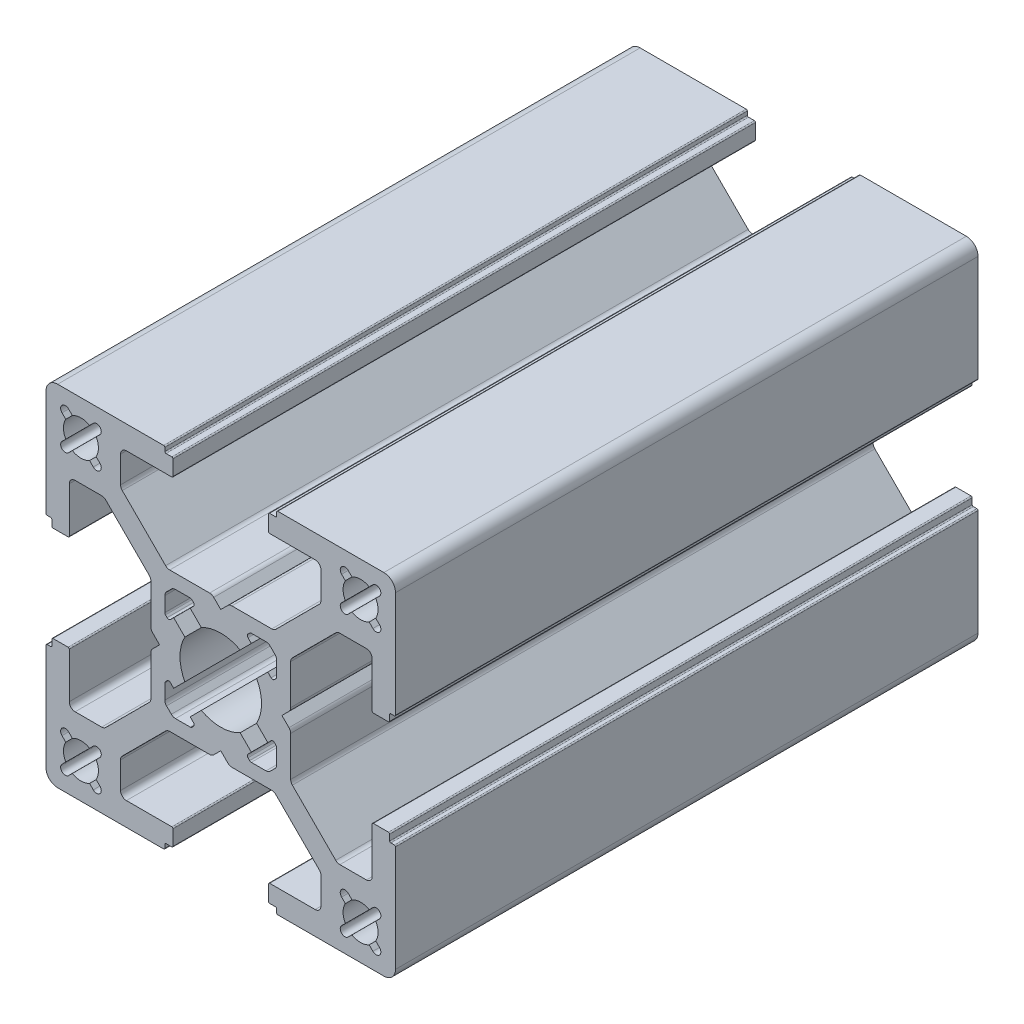
from build123d import *

# Parameters (mm, degrees)
Y_KSEKLIK_EKSTR_ZYON1_DEPTH = 50


with BuildPart() as part:
    # Çizim1 → Yükseklik-Ekstrüzyon1 (new body)
    with BuildSketch(Plane.XY):
        with BuildLine():
            Line((-4.8, 14.6), (-4.8, 14.9))
            ThreePointArc((-4.8, 14.9), (-4.829289322, 14.970710678), (-4.9, 15))
            Line((-4.9, 15), (-14, 15))
            ThreePointArc((-14, 15), (-14.707106781, 14.707106781), (-15, 14))
            Line((-15, 14), (-15, 4.9))
            ThreePointArc((-15, 4.9), (-14.970710678, 4.829289322), (-14.9, 4.8))
            Line((-14.9, 4.8), (-14.6, 4.8))
            ThreePointArc((-14.6, 4.8), (-14.529289322, 4.770710678), (-14.5, 4.7))
            Line((-14.5, 4.7), (-14.5, 4.2))
            ThreePointArc((-14.5, 4.2), (-14.470710678, 4.129289322), (-14.4, 4.1))
            Line((-14.4, 4.1), (-13.1, 4.1))
            ThreePointArc((-13.1, 4.1), (-13.029289322, 4.129289322), (-13, 4.2))
            Line((-13, 4.2), (-13, 8.1))
            ThreePointArc((-13, 8.1), (-12.853553391, 8.453553391), (-12.5, 8.6))
            Line((-12.5, 8.6), (-10.221320344, 8.6))
            ThreePointArc((-10.221320344, 8.6), (-10.029978627, 8.561939766), (-9.867766953, 8.453553391))
            Line((-9.867766953, 8.453553391), (-6.146446609, 4.732233047))
            ThreePointArc((-6.146446609, 4.732233047), (-6.038060234, 4.570021373), (-6, 4.378679656))
            Line((-6, 4.378679656), (-6, 0.957106781))
            ThreePointArc((-6, 0.957106781), (-5.961939766, 0.765765065), (-5.853553391, 0.603553391))
            Line((-5.853553391, 0.603553391), (-5.25, 0))
            Line((-5.25, 0), (-5.853553391, -0.603553391))
            ThreePointArc((-5.853553391, -0.603553391), (-5.961939766, -0.765765065), (-6, -0.957106781))
            Line((-6, -0.957106781), (-6, -4.378679656))
            ThreePointArc((-6, -4.378679656), (-6.038060234, -4.570021373), (-6.146446609, -4.732233047))
            Line((-6.146446609, -4.732233047), (-9.867766953, -8.453553391))
            ThreePointArc((-9.867766953, -8.453553391), (-10.029978627, -8.561939766), (-10.221320344, -8.6))
            Line((-10.221320344, -8.6), (-12.5, -8.6))
            ThreePointArc((-12.5, -8.6), (-12.853553391, -8.453553391), (-13, -8.1))
            Line((-13, -8.1), (-13, -4.2))
            ThreePointArc((-13, -4.2), (-13.029289322, -4.129289322), (-13.1, -4.1))
            Line((-13.1, -4.1), (-14.4, -4.1))
            ThreePointArc((-14.4, -4.1), (-14.470710678, -4.129289322), (-14.5, -4.2))
            Line((-14.5, -4.2), (-14.5, -4.7))
            ThreePointArc((-14.5, -4.7), (-14.529289322, -4.770710678), (-14.6, -4.8))
            Line((-14.6, -4.8), (-14.9, -4.8))
            ThreePointArc((-14.9, -4.8), (-14.970710678, -4.829289322), (-15, -4.9))
            Line((-15, -4.9), (-15, -14))
            ThreePointArc((-15, -14), (-14.707106781, -14.707106781), (-14, -15))
            Line((-14, -15), (-4.9, -15))
            ThreePointArc((-4.9, -15), (-4.829289322, -14.970710678), (-4.8, -14.9))
            Line((-4.8, -14.9), (-4.8, -14.6))
            ThreePointArc((-4.8, -14.6), (-4.770710678, -14.529289322), (-4.7, -14.5))
            Line((-4.7, -14.5), (-4.2, -14.5))
            ThreePointArc((-4.2, -14.5), (-4.129289322, -14.470710678), (-4.1, -14.4))
            Line((-4.1, -14.4), (-4.1, -13.1))
            ThreePointArc((-4.1, -13.1), (-4.129289322, -13.029289322), (-4.2, -13))
            Line((-4.2, -13), (-8.1, -13))
            ThreePointArc((-8.1, -13), (-8.453553391, -12.853553391), (-8.6, -12.5))
            Line((-8.6, -12.5), (-8.6, -10.221320344))
            ThreePointArc((-8.6, -10.221320344), (-8.561939766, -10.029978627), (-8.453553391, -9.867766953))
            Line((-8.453553391, -9.867766953), (-4.732233047, -6.146446609))
            ThreePointArc((-4.732233047, -6.146446609), (-4.570021373, -6.038060234), (-4.378679656, -6))
            Line((-4.378679656, -6), (-0.957106781, -6))
            ThreePointArc((-0.957106781, -6), (-0.765765065, -5.961939766), (-0.603553391, -5.853553391))
            Line((-0.603553391, -5.853553391), (0, -5.25))
            Line((0, -5.25), (0.603553391, -5.853553391))
            ThreePointArc((0.603553391, -5.853553391), (0.765765065, -5.961939766), (0.957106781, -6))
            Line((0.957106781, -6), (4.378679656, -6))
            ThreePointArc((4.378679656, -6), (4.570021373, -6.038060234), (4.732233047, -6.146446609))
            Line((4.732233047, -6.146446609), (8.453553391, -9.867766953))
            ThreePointArc((8.453553391, -9.867766953), (8.561939766, -10.029978627), (8.6, -10.221320344))
            Line((8.6, -10.221320344), (8.6, -12.5))
            ThreePointArc((8.6, -12.5), (8.453553391, -12.853553391), (8.1, -13))
            Line((8.1, -13), (4.2, -13))
            ThreePointArc((4.2, -13), (4.129289322, -13.029289322), (4.1, -13.1))
            Line((4.1, -13.1), (4.1, -14.4))
            ThreePointArc((4.1, -14.4), (4.129289322, -14.470710678), (4.2, -14.5))
            Line((4.2, -14.5), (4.7, -14.5))
            ThreePointArc((4.7, -14.5), (4.770710678, -14.529289322), (4.8, -14.6))
            Line((4.8, -14.6), (4.8, -14.9))
            ThreePointArc((4.8, -14.9), (4.829289322, -14.970710678), (4.9, -15))
            Line((4.9, -15), (14, -15))
            ThreePointArc((14, -15), (14.707106781, -14.707106781), (15, -14))
            Line((15, -14), (15, -4.9))
            ThreePointArc((15, -4.9), (14.970710678, -4.829289322), (14.9, -4.8))
            Line((14.9, -4.8), (14.6, -4.8))
            ThreePointArc((14.6, -4.8), (14.529289322, -4.770710678), (14.5, -4.7))
            Line((14.5, -4.7), (14.5, -4.2))
            ThreePointArc((14.5, -4.2), (14.470710678, -4.129289322), (14.4, -4.1))
            Line((14.4, -4.1), (13.1, -4.1))
            ThreePointArc((13.1, -4.1), (13.029289322, -4.129289322), (13, -4.2))
            Line((13, -4.2), (13, -8.1))
            ThreePointArc((13, -8.1), (12.853553391, -8.453553391), (12.5, -8.6))
            Line((12.5, -8.6), (10.221320344, -8.6))
            ThreePointArc((10.221320344, -8.6), (10.029978627, -8.561939766), (9.867766953, -8.453553391))
            Line((9.867766953, -8.453553391), (6.146446609, -4.732233047))
            ThreePointArc((6.146446609, -4.732233047), (6.038060234, -4.570021373), (6, -4.378679656))
            Line((6, -4.378679656), (6, -0.957106781))
            ThreePointArc((6, -0.957106781), (5.961939766, -0.765765065), (5.853553391, -0.603553391))
            Line((5.853553391, -0.603553391), (5.25, 0))
            Line((5.25, 0), (5.853553391, 0.603553391))
            ThreePointArc((5.853553391, 0.603553391), (5.961939766, 0.765765065), (6, 0.957106781))
            Line((6, 0.957106781), (6, 4.378679656))
            ThreePointArc((6, 4.378679656), (6.038060234, 4.570021373), (6.146446609, 4.732233047))
            Line((6.146446609, 4.732233047), (9.867766953, 8.453553391))
            ThreePointArc((9.867766953, 8.453553391), (10.029978627, 8.561939766), (10.221320344, 8.6))
            Line((10.221320344, 8.6), (12.5, 8.6))
            ThreePointArc((12.5, 8.6), (12.853553391, 8.453553391), (13, 8.1))
            Line((13, 8.1), (13, 4.2))
            ThreePointArc((13, 4.2), (13.029289322, 4.129289322), (13.1, 4.1))
            Line((13.1, 4.1), (14.4, 4.1))
            ThreePointArc((14.4, 4.1), (14.470710678, 4.129289322), (14.5, 4.2))
            Line((14.5, 4.2), (14.5, 4.7))
            ThreePointArc((14.5, 4.7), (14.529289322, 4.770710678), (14.6, 4.8))
            Line((14.6, 4.8), (14.9, 4.8))
            ThreePointArc((14.9, 4.8), (14.970710678, 4.829289322), (15, 4.9))
            Line((15, 4.9), (15, 14))
            ThreePointArc((15, 14), (14.707106781, 14.707106781), (14, 15))
            Line((14, 15), (4.9, 15))
            ThreePointArc((4.9, 15), (4.829289322, 14.970710678), (4.8, 14.9))
            Line((4.8, 14.9), (4.8, 14.6))
            ThreePointArc((4.8, 14.6), (4.770710678, 14.529289322), (4.7, 14.5))
            Line((4.7, 14.5), (4.2, 14.5))
            ThreePointArc((4.2, 14.5), (4.129289322, 14.470710678), (4.1, 14.4))
            Line((4.1, 14.4), (4.1, 13.1))
            ThreePointArc((4.1, 13.1), (4.129289322, 13.029289322), (4.2, 13))
            Line((4.2, 13), (8.1, 13))
            ThreePointArc((8.1, 13), (8.453553391, 12.853553391), (8.6, 12.5))
            Line((8.6, 12.5), (8.6, 10.221320344))
            ThreePointArc((8.6, 10.221320344), (8.561939766, 10.029978627), (8.453553391, 9.867766953))
            Line((8.453553391, 9.867766953), (4.732233047, 6.146446609))
            ThreePointArc((4.732233047, 6.146446609), (4.570021373, 6.038060234), (4.378679656, 6))
            Line((4.378679656, 6), (0.957106781, 6))
            ThreePointArc((0.957106781, 6), (0.765765065, 5.961939766), (0.603553391, 5.853553391))
            Line((0.603553391, 5.853553391), (0, 5.25))
            Line((0, 5.25), (-0.603553391, 5.853553391))
            ThreePointArc((-0.603553391, 5.853553391), (-0.765765065, 5.961939766), (-0.957106781, 6))
            Line((-0.957106781, 6), (-4.378679656, 6))
            ThreePointArc((-4.378679656, 6), (-4.570021373, 6.038060234), (-4.732233047, 6.146446609))
            Line((-4.732233047, 6.146446609), (-8.453553391, 9.867766953))
            ThreePointArc((-8.453553391, 9.867766953), (-8.561939766, 10.029978627), (-8.6, 10.221320344))
            Line((-8.6, 10.221320344), (-8.6, 12.5))
            ThreePointArc((-8.6, 12.5), (-8.453553391, 12.853553391), (-8.1, 13))
            Line((-8.1, 13), (-4.2, 13))
            ThreePointArc((-4.2, 13), (-4.129289322, 13.029289322), (-4.1, 13.1))
            Line((-4.1, 13.1), (-4.1, 14.4))
            ThreePointArc((-4.1, 14.4), (-4.129289322, 14.470710678), (-4.2, 14.5))
            Line((-4.2, 14.5), (-4.7, 14.5))
            ThreePointArc((-4.7, 14.5), (-4.770710678, 14.529289322), (-4.8, 14.6))
        make_face()
        with BuildLine():
            Line((-1.664601464, -3.078815026), (-2.624264069, -4.038477631))
            Line((-2.624264069, -4.038477631), (-2.341421356, -4.321320344))
            ThreePointArc((-2.341421356, -4.321320344), (-2.282842712, -4.4627417), (-2.341421356, -4.604163056))
            Line((-2.341421356, -4.604163056), (-2.478679656, -4.741421356))
            ThreePointArc((-2.478679656, -4.741421356), (-2.543564326, -4.784775907), (-2.620101013, -4.8))
            Line((-2.620101013, -4.8), (-3.885786438, -4.8))
            ThreePointArc((-3.885786438, -4.8), (-4.077128154, -4.761939766), (-4.239339828, -4.653553391))
            Line((-4.239339828, -4.653553391), (-4.653553391, -4.239339828))
            ThreePointArc((-4.653553391, -4.239339828), (-4.761939766, -4.077128154), (-4.8, -3.885786438))
            Line((-4.8, -3.885786438), (-4.8, -2.620101013))
            ThreePointArc((-4.8, -2.620101013), (-4.784775907, -2.543564326), (-4.741421356, -2.478679656))
            Line((-4.741421356, -2.478679656), (-4.604163056, -2.341421356))
            ThreePointArc((-4.604163056, -2.341421356), (-4.4627417, -2.282842712), (-4.321320344, -2.341421356))
            Line((-4.321320344, -2.341421356), (-4.038477631, -2.624264069))
            Line((-4.038477631, -2.624264069), (-3.078815026, -1.664601464))
            ThreePointArc((-3.078815026, -1.664601464), (-3.5, 0), (-3.078815026, 1.664601464))
            Line((-3.078815026, 1.664601464), (-4.038477631, 2.624264069))
            Line((-4.038477631, 2.624264069), (-4.321320344, 2.341421356))
            ThreePointArc((-4.321320344, 2.341421356), (-4.4627417, 2.282842712), (-4.604163056, 2.341421356))
            Line((-4.604163056, 2.341421356), (-4.741421356, 2.478679656))
            ThreePointArc((-4.741421356, 2.478679656), (-4.784775907, 2.543564326), (-4.8, 2.620101013))
            Line((-4.8, 2.620101013), (-4.8, 3.885786438))
            ThreePointArc((-4.8, 3.885786438), (-4.761939766, 4.077128154), (-4.653553391, 4.239339828))
            Line((-4.653553391, 4.239339828), (-4.239339828, 4.653553391))
            ThreePointArc((-4.239339828, 4.653553391), (-4.077128154, 4.761939766), (-3.885786438, 4.8))
            Line((-3.885786438, 4.8), (-2.620101013, 4.8))
            ThreePointArc((-2.620101013, 4.8), (-2.543564326, 4.784775907), (-2.478679656, 4.741421356))
            Line((-2.478679656, 4.741421356), (-2.341421356, 4.604163056))
            ThreePointArc((-2.341421356, 4.604163056), (-2.282842712, 4.4627417), (-2.341421356, 4.321320344))
            Line((-2.341421356, 4.321320344), (-2.624264069, 4.038477631))
            Line((-2.624264069, 4.038477631), (-1.664601464, 3.078815026))
            ThreePointArc((-1.664601464, 3.078815026), (0, 3.5), (1.664601464, 3.078815026))
            Line((1.664601464, 3.078815026), (2.624264069, 4.038477631))
            Line((2.624264069, 4.038477631), (2.341421356, 4.321320344))
            ThreePointArc((2.341421356, 4.321320344), (2.282842712, 4.4627417), (2.341421356, 4.604163056))
            Line((2.341421356, 4.604163056), (2.478679656, 4.741421356))
            ThreePointArc((2.478679656, 4.741421356), (2.543564326, 4.784775907), (2.620101013, 4.8))
            Line((2.620101013, 4.8), (3.885786438, 4.8))
            ThreePointArc((3.885786438, 4.8), (4.077128154, 4.761939766), (4.239339828, 4.653553391))
            Line((4.239339828, 4.653553391), (4.653553391, 4.239339828))
            ThreePointArc((4.653553391, 4.239339828), (4.761939766, 4.077128154), (4.8, 3.885786438))
            Line((4.8, 3.885786438), (4.8, 2.620101013))
            ThreePointArc((4.8, 2.620101013), (4.784775907, 2.543564326), (4.741421356, 2.478679656))
            Line((4.741421356, 2.478679656), (4.604163056, 2.341421356))
            ThreePointArc((4.604163056, 2.341421356), (4.4627417, 2.282842712), (4.321320344, 2.341421356))
            Line((4.321320344, 2.341421356), (4.038477631, 2.624264069))
            Line((4.038477631, 2.624264069), (3.078815026, 1.664601464))
            ThreePointArc((3.078815026, 1.664601464), (3.5, 0), (3.078815026, -1.664601464))
            Line((3.078815026, -1.664601464), (4.038477631, -2.624264069))
            Line((4.038477631, -2.624264069), (4.321320344, -2.341421356))
            ThreePointArc((4.321320344, -2.341421356), (4.4627417, -2.282842712), (4.604163056, -2.341421356))
            Line((4.604163056, -2.341421356), (4.741421356, -2.478679656))
            ThreePointArc((4.741421356, -2.478679656), (4.784775907, -2.543564326), (4.8, -2.620101013))
            Line((4.8, -2.620101013), (4.8, -3.885786438))
            ThreePointArc((4.8, -3.885786438), (4.761939766, -4.077128154), (4.653553391, -4.239339828))
            Line((4.653553391, -4.239339828), (4.239339828, -4.653553391))
            ThreePointArc((4.239339828, -4.653553391), (4.077128154, -4.761939766), (3.885786438, -4.8))
            Line((3.885786438, -4.8), (2.620101013, -4.8))
            ThreePointArc((2.620101013, -4.8), (2.543564326, -4.784775907), (2.478679656, -4.741421356))
            Line((2.478679656, -4.741421356), (2.341421356, -4.604163056))
            ThreePointArc((2.341421356, -4.604163056), (2.282842712, -4.4627417), (2.341421356, -4.321320344))
            Line((2.341421356, -4.321320344), (2.624264069, -4.038477631))
            Line((2.624264069, -4.038477631), (1.664601464, -3.078815026))
            ThreePointArc((1.664601464, -3.078815026), (0, -3.5), (-1.664601464, -3.078815026))
        make_face(mode=Mode.SUBTRACT)
        with BuildLine():
            ThreePointArc((-12.739409703, 13.305095127), (-12, 13.5), (-11.260590297, 13.305095127))
            Line((-11.260590297, 13.305095127), (-10.939339828, 13.626345597))
            ThreePointArc((-10.939339828, 13.626345597), (-10.373654403, 13.626345597), (-10.373654403, 13.060660172))
            Line((-10.373654403, 13.060660172), (-10.694904873, 12.739409703))
            ThreePointArc((-10.694904873, 12.739409703), (-10.5, 12), (-10.694904873, 11.260590297))
            Line((-10.694904873, 11.260590297), (-10.373654403, 10.939339828))
            ThreePointArc((-10.373654403, 10.939339828), (-10.373654403, 10.373654403), (-10.939339828, 10.373654403))
            Line((-10.939339828, 10.373654403), (-11.260590297, 10.694904873))
            ThreePointArc((-11.260590297, 10.694904873), (-12, 10.5), (-12.739409703, 10.694904873))
            Line((-12.739409703, 10.694904873), (-13.060660172, 10.373654403))
            ThreePointArc((-13.060660172, 10.373654403), (-13.626345597, 10.373654403), (-13.626345597, 10.939339828))
            Line((-13.626345597, 10.939339828), (-13.305095127, 11.260590297))
            ThreePointArc((-13.305095127, 11.260590297), (-13.5, 12), (-13.305095127, 12.739409703))
            Line((-13.305095127, 12.739409703), (-13.626345597, 13.060660172))
            ThreePointArc((-13.626345597, 13.060660172), (-13.626345597, 13.626345597), (-13.060660172, 13.626345597))
            Line((-13.060660172, 13.626345597), (-12.739409703, 13.305095127))
        make_face(mode=Mode.SUBTRACT)
        with BuildLine():
            Line((13.305095127, 11.260590297), (13.626345597, 10.939339828))
            ThreePointArc((13.626345597, 10.939339828), (13.626345597, 10.373654403), (13.060660172, 10.373654403))
            Line((13.060660172, 10.373654403), (12.739409703, 10.694904873))
            ThreePointArc((12.739409703, 10.694904873), (12, 10.5), (11.260590297, 10.694904873))
            Line((11.260590297, 10.694904873), (10.939339828, 10.373654403))
            ThreePointArc((10.939339828, 10.373654403), (10.373654403, 10.373654403), (10.373654403, 10.939339828))
            Line((10.373654403, 10.939339828), (10.694904873, 11.260590297))
            ThreePointArc((10.694904873, 11.260590297), (10.5, 12), (10.694904873, 12.739409703))
            Line((10.694904873, 12.739409703), (10.373654403, 13.060660172))
            ThreePointArc((10.373654403, 13.060660172), (10.373654403, 13.626345597), (10.939339828, 13.626345597))
            Line((10.939339828, 13.626345597), (11.260590297, 13.305095127))
            ThreePointArc((11.260590297, 13.305095127), (12, 13.5), (12.739409703, 13.305095127))
            Line((12.739409703, 13.305095127), (13.060660172, 13.626345597))
            ThreePointArc((13.060660172, 13.626345597), (13.626345597, 13.626345597), (13.626345597, 13.060660172))
            Line((13.626345597, 13.060660172), (13.305095127, 12.739409703))
            ThreePointArc((13.305095127, 12.739409703), (13.5, 12), (13.305095127, 11.260590297))
        make_face(mode=Mode.SUBTRACT)
        with BuildLine():
            Line((-13.305095127, -11.260590297), (-13.626345597, -10.939339828))
            ThreePointArc((-13.626345597, -10.939339828), (-13.626345597, -10.373654403), (-13.060660172, -10.373654403))
            Line((-13.060660172, -10.373654403), (-12.739409703, -10.694904873))
            ThreePointArc((-12.739409703, -10.694904873), (-12, -10.5), (-11.260590297, -10.694904873))
            Line((-11.260590297, -10.694904873), (-10.939339828, -10.373654403))
            ThreePointArc((-10.939339828, -10.373654403), (-10.373654403, -10.373654403), (-10.373654403, -10.939339828))
            Line((-10.373654403, -10.939339828), (-10.694904873, -11.260590297))
            ThreePointArc((-10.694904873, -11.260590297), (-10.5, -12), (-10.694904873, -12.739409703))
            Line((-10.694904873, -12.739409703), (-10.373654403, -13.060660172))
            ThreePointArc((-10.373654403, -13.060660172), (-10.373654403, -13.626345597), (-10.939339828, -13.626345597))
            Line((-10.939339828, -13.626345597), (-11.260590297, -13.305095127))
            ThreePointArc((-11.260590297, -13.305095127), (-12, -13.5), (-12.739409703, -13.305095127))
            Line((-12.739409703, -13.305095127), (-13.060660172, -13.626345597))
            ThreePointArc((-13.060660172, -13.626345597), (-13.626345597, -13.626345597), (-13.626345597, -13.060660172))
            Line((-13.626345597, -13.060660172), (-13.305095127, -12.739409703))
            ThreePointArc((-13.305095127, -12.739409703), (-13.5, -12), (-13.305095127, -11.260590297))
        make_face(mode=Mode.SUBTRACT)
        with BuildLine():
            ThreePointArc((10.939339828, -13.626345597), (10.373654403, -13.626345597), (10.373654403, -13.060660172))
            Line((10.373654403, -13.060660172), (10.694904873, -12.739409703))
            ThreePointArc((10.694904873, -12.739409703), (10.5, -12), (10.694904873, -11.260590297))
            Line((10.694904873, -11.260590297), (10.373654403, -10.939339828))
            ThreePointArc((10.373654403, -10.939339828), (10.373654403, -10.373654403), (10.939339828, -10.373654403))
            Line((10.939339828, -10.373654403), (11.260590297, -10.694904873))
            ThreePointArc((11.260590297, -10.694904873), (12, -10.5), (12.739409703, -10.694904873))
            Line((12.739409703, -10.694904873), (13.060660172, -10.373654403))
            ThreePointArc((13.060660172, -10.373654403), (13.626345597, -10.373654403), (13.626345597, -10.939339828))
            Line((13.626345597, -10.939339828), (13.305095127, -11.260590297))
            ThreePointArc((13.305095127, -11.260590297), (13.5, -12), (13.305095127, -12.739409703))
            Line((13.305095127, -12.739409703), (13.626345597, -13.060660172))
            ThreePointArc((13.626345597, -13.060660172), (13.626345597, -13.626345597), (13.060660172, -13.626345597))
            Line((13.060660172, -13.626345597), (12.739409703, -13.305095127))
            ThreePointArc((12.739409703, -13.305095127), (12, -13.5), (11.260590297, -13.305095127))
            Line((11.260590297, -13.305095127), (10.939339828, -13.626345597))
        make_face(mode=Mode.SUBTRACT)
    extrude(amount=-Y_KSEKLIK_EKSTR_ZYON1_DEPTH)


solid = part.part
